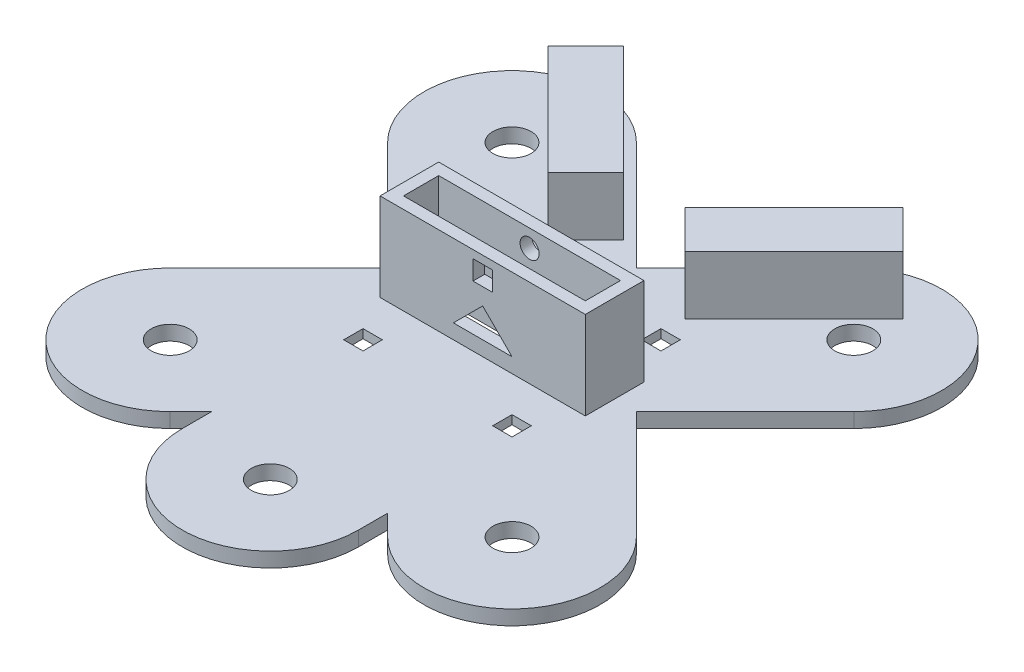
from build123d import *

# Parameters (mm, degrees)
BOSS_EXTRU_1_DEPTH      = 5
ENL_V_MAT_EXTRU_1_DEPTH = 2
ESQUISSE7_R             = 6.5
ENL_V_MAT_EXTRU_3_DEPTH = 144.034294879
ESQUISSE10_R            = 3.175
ENL_V_MAT_EXTRU_4_DEPTH = 144.034294879
ESQUISSE11_W            = 6.6
ESQUISSE11_H            = 6.6
ENL_V_MAT_EXTRU_5_DEPTH = 3.5
BOSS_EXTRU_8_DEPTH      = 20
ESQUISSE18_W            = 70
ESQUISSE18_H            = 20
ESQUISSE18_W_2          = 62
ESQUISSE18_H_2          = 12
BOSS_EXTRU_9_DEPTH      = 30
ESQUISSE19_R            = 3.25
ENL_V_MAT_EXTRU_6_DEPTH = 140.679208812
ESQUISSE20_W            = 6.6
ESQUISSE20_H            = 6.6
ENL_V_MAT_EXTRU_7_DEPTH = 4
ESQUISSE21_W            = 40
ESQUISSE21_H            = 10
ENL_V_MAT_EXTRU_8_DEPTH = 147.060978744
ENL_V_MAT_EXTRU_9_DEPTH = 155.943014199


with BuildPart() as part:
    # Esquisse2 → Boss.-Extru.1 (new body)
    with BuildSketch(Plane(origin=(0, 0, 0), x_dir=(1, 0, 0), z_dir=(0, 1, 0))):
        with BuildLine():
            Line((79.497474683, -37.071067812), (42.426406871, 0))
            Line((42.426406871, 0), (79.497474683, 37.071067812))
            ThreePointArc((79.497474683, 37.071067812), (79.497474683, 79.497474683), (37.071067812, 79.497474683))
            Line((37.071067812, 79.497474683), (0, 42.426406871))
            Line((0, 42.426406871), (-37.071067812, 79.497474683))
            ThreePointArc((-37.071067812, 79.497474683), (-79.497474683, 79.497474683), (-79.497474683, 37.071067812))
            Line((-79.497474683, 37.071067812), (-42.426406871, 0))
            Line((-42.426406871, 0), (-79.497474683, -37.071067812))
            ThreePointArc((-79.497474683, -37.071067812), (-79.497474683, -79.497474683), (-37.071067812, -79.497474683))
            Line((-37.071067812, -79.497474683), (-30, -72.426406871))
            Line((-30, -72.426406871), (-30, -82.426406871))
            ThreePointArc((-30, -82.426406871), (0, -112.426406871), (30, -82.426406871))
            Line((30, -82.426406871), (30, -72.426406871))
            Line((30, -72.426406871), (37.071067812, -79.497474683))
            ThreePointArc((37.071067812, -79.497474683), (79.497474683, -79.497474683), (79.497474683, -37.071067812))
        make_face()
    extrude(amount=BOSS_EXTRU_1_DEPTH)

    # Esquisse4 → Enlèv. mat.-Extru.1 (cut)
    with BuildSketch(Plane(origin=(0, 0, 0), x_dir=(-1, 0, 0), z_dir=(0, -1, 0))):
        with BuildLine():
            Line((-33.535533906, -33.535533906), (-18.245921943, -18.245921943))
            Line((-18.245921943, -18.245921943), (-28.852523661, -7.639320225))
            Line((-28.852523661, -7.639320225), (-46.53019319, -25.316989755))
            ThreePointArc((-46.53019319, -25.316989755), (-39.575984314, -28.703872332), (-33.535533906, -33.535533906))
        make_face()
        with BuildLine():
            Line((-7.639320225, -28.852523661), (-18.245921943, -18.245921943))
            Line((-18.245921943, -18.245921943), (-33.535533906, -33.535533906))
            ThreePointArc((-33.535533906, -33.535533906), (-28.703872332, -39.575984314), (-25.316989755, -46.53019319))
            Line((-25.316989755, -46.53019319), (-7.639320225, -28.852523661))
        make_face()
        with BuildLine():
            ThreePointArc((-46.53019319, 25.316989755), (-33.535533906, 33.535533906), (-25.316989755, 46.53019319))
            Line((-25.316989755, 46.53019319), (-7.639320225, 28.852523661))
            Line((-7.639320225, 28.852523661), (-28.852523661, 7.639320225))
            Line((-28.852523661, 7.639320225), (-46.53019319, 25.316989755))
        make_face()
        with BuildLine():
            ThreePointArc((25.316989755, 46.53019319), (33.535533906, 33.535533906), (46.53019319, 25.316989755))
            Line((46.53019319, 25.316989755), (28.852523661, 7.639320225))
            Line((28.852523661, 7.639320225), (7.639320225, 28.852523661))
            Line((7.639320225, 28.852523661), (25.316989755, 46.53019319))
        make_face()
        with BuildLine():
            ThreePointArc((46.53019319, -25.316989755), (33.535533906, -33.535533906), (25.316989755, -46.53019319))
            Line((25.316989755, -46.53019319), (7.639320225, -28.852523661))
            Line((7.639320225, -28.852523661), (28.852523661, -7.639320225))
            Line((28.852523661, -7.639320225), (46.53019319, -25.316989755))
        make_face()
    extrude(amount=-ENL_V_MAT_EXTRU_1_DEPTH, mode=Mode.SUBTRACT)

    # Esquisse7 → Enlèv. mat.-Extru.3 (cut, through all)
    with BuildSketch(Plane(origin=(0, 0, 0), x_dir=(-1, 0, 0), z_dir=(0, -1, 0))):
        with Locations(Location((0, -82.426406871, 0), (0, 0, 90))):
            Circle(ESQUISSE7_R)
        with Locations(Location((-58.284271247, -58.284271247, 0), (0, 0, 90))):
            Circle(ESQUISSE7_R)
        with Locations(Location((-58.284271247, 58.284271247, 0), (0, 0, 90))):
            Circle(ESQUISSE7_R)
        with Locations(Location((58.284271247, 58.284271247, 0), (0, 0, 90))):
            Circle(ESQUISSE7_R)
        with Locations(Location((58.284271247, -58.284271247, 0), (0, 0, 90))):
            Circle(ESQUISSE7_R)
    extrude(amount=-ENL_V_MAT_EXTRU_3_DEPTH, mode=Mode.SUBTRACT)

    # Esquisse10 → Enlèv. mat.-Extru.4 (cut, through all)
    with BuildSketch(Plane(origin=(0, 5, 0), x_dir=(1, 0, 0), z_dir=(0, 1, 0))):
        with Locations(Location((25.403805922, -25.403805922, 0), (0, 0, 270))):
            Circle(ESQUISSE10_R)
        with Locations(Location((-25.403805922, -25.403805922, 0), (0, 0, 270))):
            Circle(ESQUISSE10_R)
        with Locations(Location((-25.403805922, 25.403805922, 0), (0, 0, 270))):
            Circle(ESQUISSE10_R)
        with Locations(Location((25.403805922, 25.403805922, 0), (0, 0, 270))):
            Circle(ESQUISSE10_R)
    extrude(amount=-ENL_V_MAT_EXTRU_4_DEPTH, mode=Mode.SUBTRACT)

    # Esquisse11 → Enlèv. mat.-Extru.5 (cut)
    with BuildSketch(Plane(origin=(0, 5, 0), x_dir=(1, 0, 0), z_dir=(0, 1, 0))):
        with Locations((-25.403805922, -25.403805922)):
            Rectangle(ESQUISSE11_W, ESQUISSE11_H)
        with Locations((25.403805922, -25.403805922)):
            Rectangle(ESQUISSE11_W, ESQUISSE11_H)
        with Locations((-25.403805922, 25.403805922)):
            Rectangle(ESQUISSE11_W, ESQUISSE11_H)
        with Locations((25.403805922, 25.403805922)):
            Rectangle(ESQUISSE11_W, ESQUISSE11_H)
    extrude(amount=-ENL_V_MAT_EXTRU_5_DEPTH, mode=Mode.SUBTRACT)

    # Esquisse16 → Boss.-Extru.8 (add)
    with BuildSketch(Plane(origin=(0, 5, 0), x_dir=(1, 0, 0), z_dir=(0, 1, 0))):
        Polygon((47.702116935, 85.698237446), (10.478031818, 48.474152329), (23.340408221, 35.611775926), (60.564493338, 72.835861043), align=None)
        Polygon((-23.340408221, 35.611775926), (-60.564493338, 72.835861043), (-47.702116935, 85.698237446), (-10.478031818, 48.474152329), align=None)
    extrude(amount=BOSS_EXTRU_8_DEPTH)

    # Esquisse18 → Boss.-Extru.9 (add)
    with BuildSketch(Plane(origin=(0, 5, 0), x_dir=(1, 0, 0), z_dir=(0, 1, 0))):
        Rectangle(ESQUISSE18_W, ESQUISSE18_H)
        Rectangle(ESQUISSE18_W_2, ESQUISSE18_H_2, mode=Mode.SUBTRACT)
    extrude(amount=BOSS_EXTRU_9_DEPTH)

    # Esquisse19 → Enlèv. mat.-Extru.6 (cut, through all)
    with BuildSketch(Plane.XY.offset(10)):
        with Locations((0, 29)):
            Circle(ESQUISSE19_R)
    extrude(amount=-ENL_V_MAT_EXTRU_6_DEPTH, mode=Mode.SUBTRACT)

    # Esquisse20 → Enlèv. mat.-Extru.7 (cut)
    with BuildSketch(Plane.XY.offset(10)):
        with Locations((0, 29)):
            Rectangle(ESQUISSE20_W, ESQUISSE20_H)
    extrude(amount=-ENL_V_MAT_EXTRU_7_DEPTH, mode=Mode.SUBTRACT)

    # Esquisse21 → Enlèv. mat.-Extru.8 (cut, through all)
    with BuildSketch(Plane(origin=(0, 5, 0), x_dir=(1, 0, 0), z_dir=(0, 1, 0))):
        Rectangle(ESQUISSE21_W, ESQUISSE21_H)
    extrude(amount=-ENL_V_MAT_EXTRU_8_DEPTH, mode=Mode.SUBTRACT)

    # Esquisse22 → Enlèv. mat.-Extru.9 (cut, through all)
    with BuildSketch(Plane(origin=(0, 0, -10), x_dir=(-1, 0, 0), z_dir=(0, 0, -1))):
        Polygon((-10, 10), (10, 10), (0, 20), align=None)
    extrude(amount=-ENL_V_MAT_EXTRU_9_DEPTH, mode=Mode.SUBTRACT)


solid = part.part
